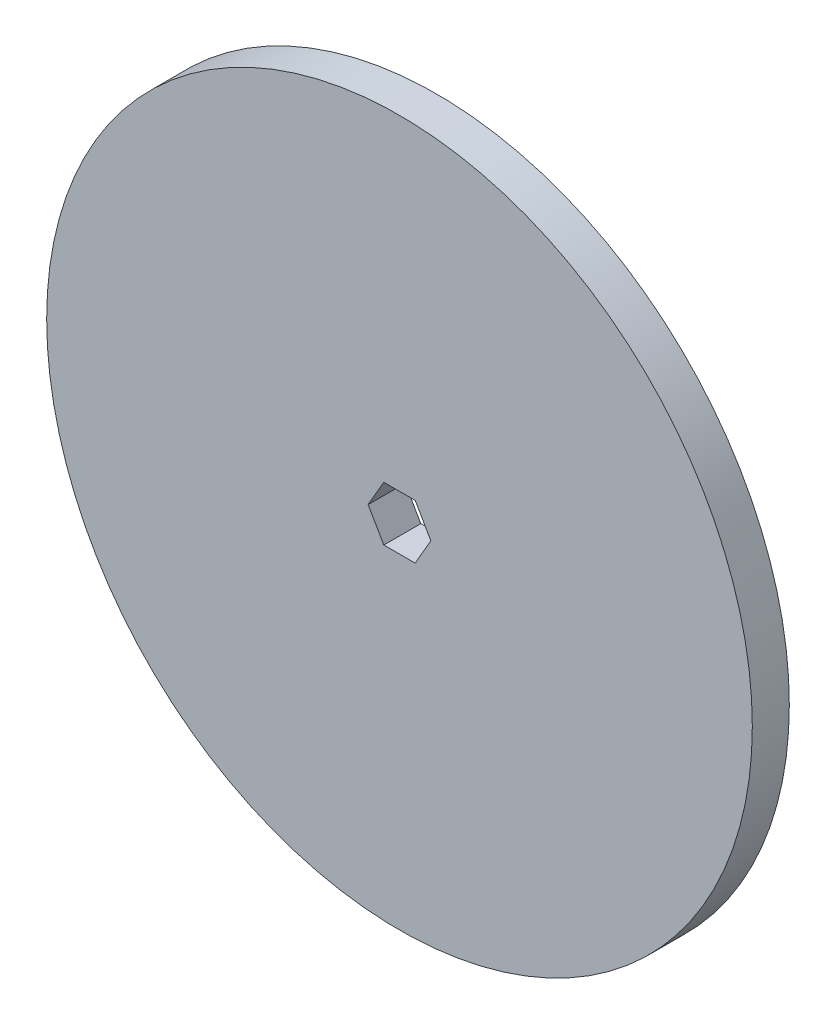
from build123d import *

# Parameters (mm, degrees)
SKETCH1_R           = 57.15
BOSS_EXTRUDE1_DEPTH = 5.9944
CUT_EXTRUDE1_DEPTH  = 82.044295489


with BuildPart() as part:
    # Sketch1 → Boss-Extrude1 (new body)
    with BuildSketch(Plane.XY):
        with Locations(Location((0, 0, 0), (0, 0, 180))):
            Circle(SKETCH1_R)
    extrude(amount=BOSS_EXTRUDE1_DEPTH)

    # Sketch2 → Cut-Extrude1 (cut, through all)
    with BuildSketch(Plane.XY.offset(5.9944)):
        Polygon((5.08, 0), (2.54, 4.399409051), (-2.54, 4.399409051), (-5.08, 0), (-2.54, -4.399409051), (2.54, -4.399409051), align=None)
    extrude(amount=-CUT_EXTRUDE1_DEPTH, mode=Mode.SUBTRACT)


solid = part.part
